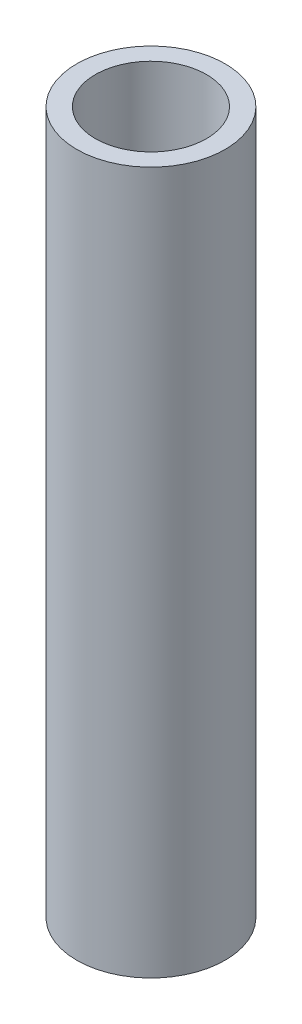
from build123d import *

# Parameters (mm, degrees)
SKETCH2_R           = 6.3754
SKETCH2_R_2         = 4.7752
BOSS_EXTRUDE1_DEPTH = 60.325


with BuildPart() as part:
    # Sketch2 → Boss-Extrude1 (new body)
    with BuildSketch(Plane(origin=(0, 0, 0), x_dir=(1, 0, 0), z_dir=(0, 1, 0))):
        with Locations(Location((0, 0, 0), (0, 0, 270))):
            Circle(SKETCH2_R)
        with Locations(Location((0, 0, 0), (0, 0, 270))):
            Circle(SKETCH2_R_2, mode=Mode.SUBTRACT)
    extrude(amount=BOSS_EXTRUDE1_DEPTH)


solid = part.part
